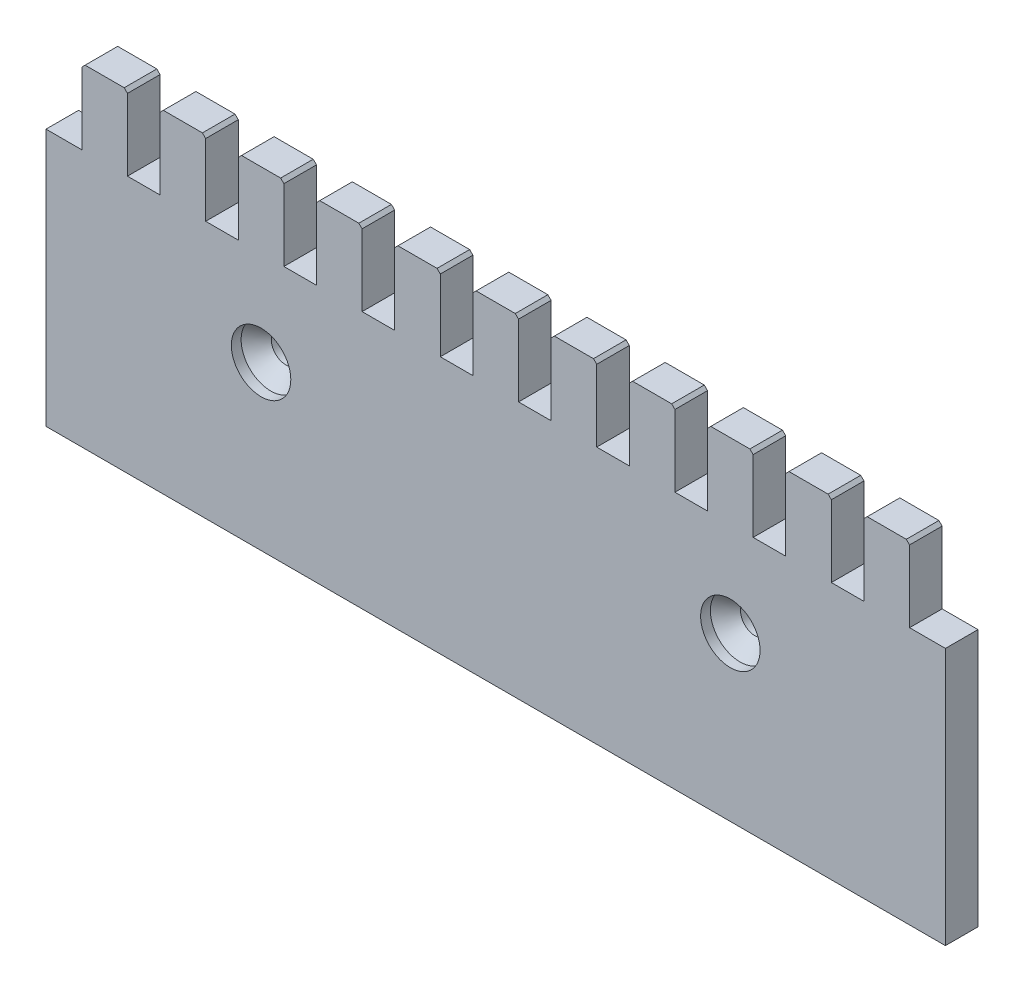
from build123d import *

# Parameters (mm, degrees)
SKETCH_1_W                  = 276
SKETCH_1_H                  = 72
EXTRUDE_1_DEPTH             = 10
CUT_EXTRUDE_1_DEPTH         = 10
SKETCH_6_W                  = 276
SKETCH_6_H                  = 10
EXTRUDE_2_DEPTH             = 30
PATTERN_LINEAR_2_COUNT      = 7
PATTERN_LINEAR_2_PITCH      = 24
PATTERN_LINEAR_2_COUNT_DIR2 = 7
PATTERN_LINEAR_2_PITCH_DIR2 = 24
SKETCH_3_R                  = 4
CUT_EXTRUDE_2_DEPTH         = 10
SKETCH_7_R                  = 9.125
CUT_EXTRUDE_3_DEPTH         = 3
SKETCH_13_W                 = 13.976331663
SKETCH_13_H                 = 30.85518014
SKETCH_13_W_2               = 8.289840829
SKETCH_13_H_2               = 27.158961097
CUT_EXTRUDE_4_DEPTH         = 10


with BuildPart() as part:
    # Эскиз1 → Бобышка-Вытянуть1 (new body)
    with BuildSketch(Plane.XY):
        Rectangle(SKETCH_1_W, SKETCH_1_H)
    extrude(amount=EXTRUDE_1_DEPTH)

    # Эскиз2 → Вырез-Вытянуть1 (cut)
    with BuildSketch(Plane.XY.offset(10)):
        Polygon((-18, 36), (-6, 36), (-7, 35), (-7, 13), (-17, 13), (-17, 35), align=None)
    cut_extrude_1 = extrude(amount=-CUT_EXTRUDE_1_DEPTH, mode=Mode.SUBTRACT)

    # Эскиз6 → Бобышка-Вытянуть2 (add)
    with BuildSketch(Plane.XZ.offset(36)):
        with Locations((0, 5)):
            Rectangle(SKETCH_6_W, SKETCH_6_H)
    extrude(amount=EXTRUDE_2_DEPTH)

    # Линейный массив2: Cut-Extrude 1 7 × 7
    with Locations(*[Vector(1, 0, 0) * (i * PATTERN_LINEAR_2_PITCH) + Vector(-1, 0, 0) * (j * PATTERN_LINEAR_2_PITCH_DIR2) for i in range(PATTERN_LINEAR_2_COUNT) for j in range(PATTERN_LINEAR_2_COUNT_DIR2) if (i, j) != (0, 0)]):
        add(cut_extrude_1, mode=Mode.SUBTRACT)

    # Эскиз3 → Вырез-Вытянуть2 (cut)
    with BuildSketch(Plane.XY.offset(10)):
        with Locations((-72, -16)):
            Circle(SKETCH_3_R)
    cut_extrude_2 = extrude(amount=-CUT_EXTRUDE_2_DEPTH, mode=Mode.SUBTRACT)

    # Эскиз7 → Вырез-Вытянуть3 (cut)
    with BuildSketch(Plane.XY.offset(10)):
        with Locations((-72, -16)):
            Circle(SKETCH_7_R)
    cut_extrude_3 = extrude(amount=-CUT_EXTRUDE_3_DEPTH, mode=Mode.SUBTRACT)

    # Эскиз12 → Зенковка для винта с потайной головкой и внутренним шестигранником M82 (revolve, cut)
    with BuildSketch(Plane(origin=(-72, -16, 7), x_dir=(0, -1, 0), z_dir=(1, 0, 0))):
        Polygon((0, 0), (0, 7), (4.5, 7), (4.5, 4.625), (9.125, 0), align=None)
    hole_wizard_m82 = revolve(axis=Axis((-72, -16, 13.35), (0, 0, -1)), mode=Mode.SUBTRACT)

    # Зеркальное отражение2: Вырез-Вытянуть2, Вырез-Вытянуть3, Зенковка для винта с потайной головкой и внутренним шестигранником M82 across plane
    add(cut_extrude_2.mirror(Plane(origin=(0, 0, 0), x_dir=(0, 0, 1), z_dir=(1, 0, 0))), mode=Mode.SUBTRACT)
    add(cut_extrude_3.mirror(Plane(origin=(0, 0, 0), x_dir=(0, 0, 1), z_dir=(1, 0, 0))), mode=Mode.SUBTRACT)
    add(hole_wizard_m82.mirror(Plane(origin=(0, 0, 0), x_dir=(0, 0, 1), z_dir=(1, 0, 0))), mode=Mode.SUBTRACT)

    # Эскиз13 → Вырез-Вытянуть4 (cut)
    with BuildSketch(Plane.XY.offset(10)):
        with Locations((-143.988165831, 28.42759007)):
            Rectangle(SKETCH_13_W, SKETCH_13_H)
        with Locations((141.144920415, 26.579480549)):
            Rectangle(SKETCH_13_W_2, SKETCH_13_H_2)
    extrude(amount=-CUT_EXTRUDE_4_DEPTH, mode=Mode.SUBTRACT)


solid = part.part
